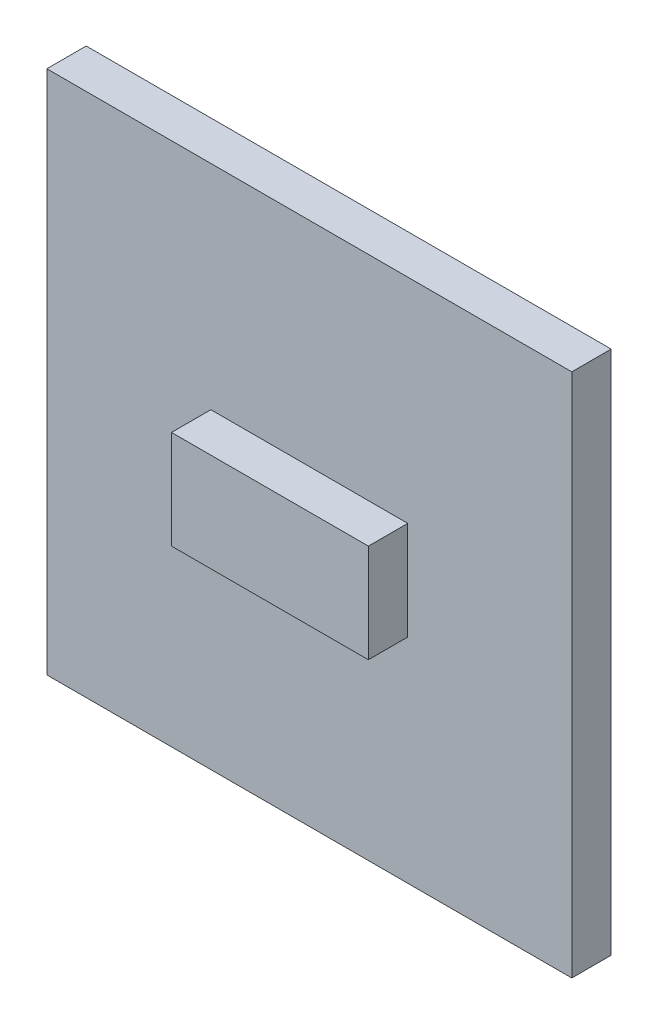
from build123d import *

# Parameters (mm, degrees)
SKETCH1_W           = 16
SKETCH1_H           = 16
BOSS_EXTRUDE1_DEPTH = 1.2
SKETCH2_W           = 6
SKETCH2_H           = 3
BOSS_EXTRUDE2_DEPTH = 1.2


with BuildPart() as part:
    # Sketch1 → Boss-Extrude1 (new body)
    with BuildSketch(Plane.XY):
        with Locations((8, -8)):
            Rectangle(SKETCH1_W, SKETCH1_H)
    extrude(amount=BOSS_EXTRUDE1_DEPTH)

    # Sketch2 → Boss-Extrude2 (add)
    with BuildSketch(Plane.XY.offset(1.2)):
        with Locations((8, -8)):
            Rectangle(SKETCH2_W, SKETCH2_H)
    extrude(amount=BOSS_EXTRUDE2_DEPTH)


solid = part.part
